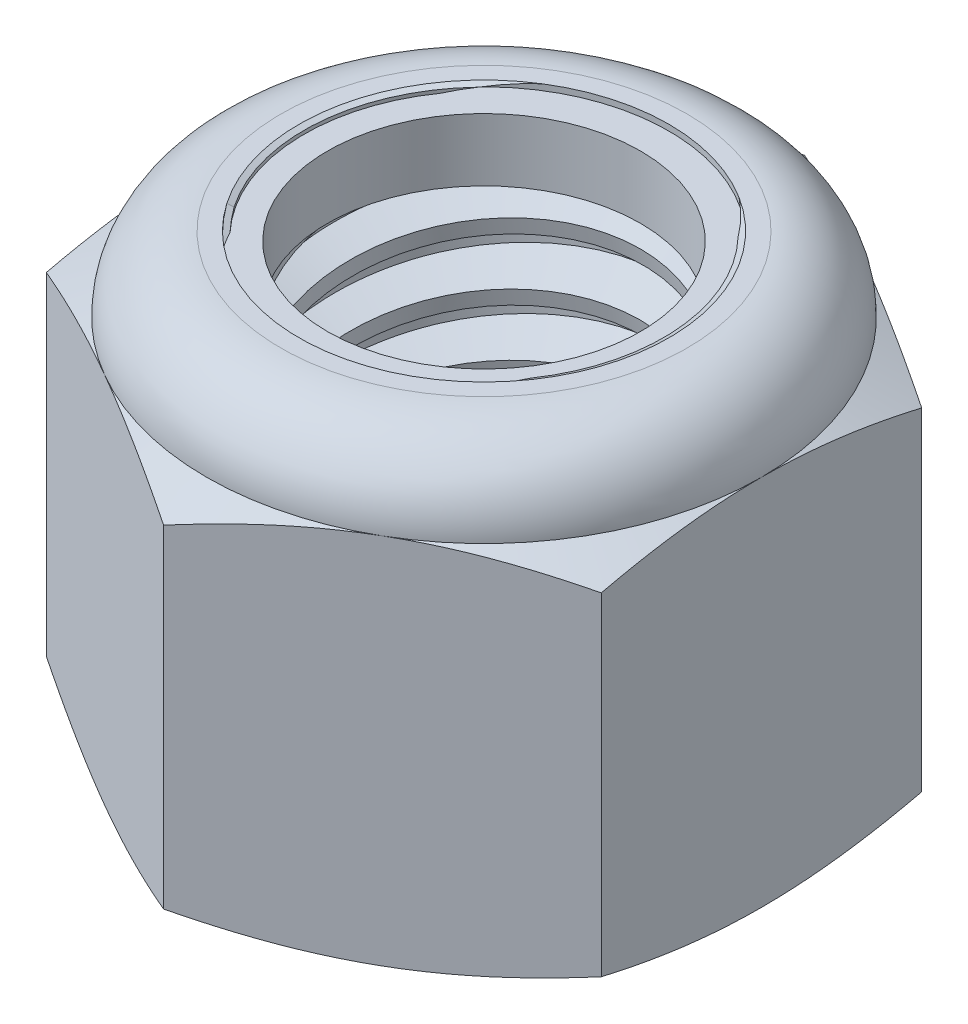
from build123d import *

# Parameters (mm, degrees)
EXTRUDE1_DEPTH      = 11.509375
SKETCH2_W           = 4.7625
SKETCH2_H           = 11.509375
LPATTERN1_COUNT     = 7
LPATTERN1_PITCH     = 1.5875
LPATTERN1_COL_COUNT = 2
LPATTERN1_COL_PITCH = 1.5875


with BuildPart() as part:
    # Sketch1 → Extrude1 (new body)
    with BuildSketch(Plane(origin=(0, 0, 0), x_dir=(1, 0, 0), z_dir=(0, 1, 0))):
        Polygon((0, 8.248891971), (-7.14375, 4.124445986), (-7.14375, -4.124445986), (0, -8.248891971), (7.14375, -4.124445986), (7.14375, 4.124445986), align=None)
    extrude(amount=EXTRUDE1_DEPTH)

    # Sketch4 → Cut-Revolve2 (revolve, cut)
    with BuildSketch(Plane(origin=(0, 0, 0), x_dir=(0, 0, -1), z_dir=(1, 0, 0)), mode=Mode.PRIVATE) as cut_revolve2_sk:
        Polygon((0, 11.509375), (4.7625, 11.509375), (4.029111805, 11.167390468), (4.029111805, 0.341984532), (4.7625, 0), (0, 0), align=None)
    revolve(cut_revolve2_sk.sketch.rotate(Axis((0, 11.509375, 0), (0, 1, 0)), 55.157981045), axis=Axis((0, 11.509375, 0), (0, 1, 0)), mode=Mode.SUBTRACT)


with BuildPart() as body_2:
    # Sketch2 → Revolve1 (revolve)
    with BuildSketch(Plane(origin=(0, 0, 0), x_dir=(0, 0, -1), z_dir=(1, 0, 0))):
        with Locations((2.38125, 5.7546875)):
            Rectangle(SKETCH2_W, SKETCH2_H)
    revolve(axis=Axis((0, -4.7625, 0), (0, 1, 0)))

    # Sketch3 → Cut-Revolve1 (revolve, cut)
    with BuildSketch(Plane(origin=(0, 0, 0), x_dir=(0, 0, -1), z_dir=(1, 0, 0)), mode=Mode.PRIVATE) as cut_revolve1_sk:
        Polygon((4.795122924, 11.313637456), (5.023483392, 9.943474646), (4.094357653, 10.291557102), (4.029111805, 10.68303219), align=None)
    cut_revolve1 = revolve(cut_revolve1_sk.sketch.rotate(Axis((0, 11.509375, 0.28317269), (0, -0.9863939238321437, -0.1643989873053572)), 180), axis=Axis((0, 11.509375, 0.28317269), (0, -0.9863939238321437, -0.1643989873053572)), mode=Mode.SUBTRACT)

    # LPattern1: Cut-Revolve1 ×7
    with Locations(*[(0, -i * LPATTERN1_PITCH, 0) for i in range(1, LPATTERN1_COUNT)]):
        add(cut_revolve1, mode=Mode.SUBTRACT)

    # LPattern1 col: Cut-Revolve1 ×2
    with Locations(*[(0, i * LPATTERN1_COL_PITCH, 0) for i in range(1, LPATTERN1_COL_COUNT)]):
        add(cut_revolve1, mode=Mode.SUBTRACT)


with BuildPart() as part_1:
    add(part.part)

    # Combine1: cut body 2
    add(body_2.part, mode=Mode.SUBTRACT)

    # Sketch5 → Cut-Revolve3 (revolve, cut)
    with BuildSketch(Plane(origin=(0, 0, 0), x_dir=(0, 0, -1), z_dir=(1, 0, 0)), mode=Mode.PRIVATE) as cut_revolve3_sk:
        with BuildLine():
            Line((0, 0), (7.14375, 0))
            Line((7.14375, 0), (8.248891971, 0.515336164))
            Line((8.248891971, 0.515336164), (8.248891971, 9.075809669))
            Line((8.248891971, 9.075809669), (7.14375, 9.591145833))
            ThreePointArc((7.14375, 9.591145833), (6.581913685, 10.947538685), (5.225520833, 11.509375))
            Line((5.225520833, 11.509375), (5.225520833, 12.779375))
            Line((5.225520833, 12.779375), (9.518891971, 12.779375))
            Line((9.518891971, 12.779375), (9.518891971, -1.27))
            Line((9.518891971, -1.27), (0, -1.27))
            Line((0, -1.27), (0, 0))
        make_face()
    revolve(cut_revolve3_sk.sketch.rotate(Axis((0, 0, 0), (0, 1, 0)), 55.157981045), axis=Axis((0, 0, 0), (0, 1, 0)), mode=Mode.SUBTRACT)

    # Sketch6 → Cut-Revolve4 (revolve, cut)
    with BuildSketch(Plane(origin=(0, 0, 0), x_dir=(0, 0, -1), z_dir=(1, 0, 0)), mode=Mode.PRIVATE) as cut_revolve4_sk:
        with BuildLine():
            Line((0, 9.591145833), (6.99135, 9.591145833))
            ThreePointArc((6.99135, 9.591145833), (6.474150612, 10.839775612), (5.225520833, 11.356975))
            Line((5.225520833, 11.356975), (4.627316319, 11.356975))
            Line((4.627316319, 11.356975), (4.627316319, 12.779375))
            Line((4.627316319, 12.779375), (0, 12.779375))
            Line((0, 12.779375), (0, 9.591145833))
        make_face()
    revolve(cut_revolve4_sk.sketch.rotate(Axis((0, 12.779375, 0), (0, 1, 0)), 55.157981045), axis=Axis((0, 12.779375, 0), (0, 1, 0)), mode=Mode.SUBTRACT)


with BuildPart() as body_2_2:
    # Sketch7 → Revolve2 (revolve)
    with BuildSketch(Plane(origin=(0, 0, 0), x_dir=(0, 0, -1), z_dir=(1, 0, 0)), mode=Mode.PRIVATE) as revolve2_sk:
        with BuildLine():
            Line((4.029111805, 9.667345833), (6.913430867, 9.667345833))
            ThreePointArc((6.913430867, 9.667345833), (6.39301751, 10.812537757), (5.225520833, 11.280775))
            Line((5.225520833, 11.280775), (4.029111805, 11.280775))
            Line((4.029111805, 11.280775), (4.029111805, 9.667345833))
        make_face()
    revolve(revolve2_sk.sketch.rotate(Axis((0, 9.667345833, 0), (0, 1, 0)), 55.157981045), axis=Axis((0, 9.667345833, 0), (0, 1, 0)))


solid = Compound([part_1.part, body_2_2.part])
